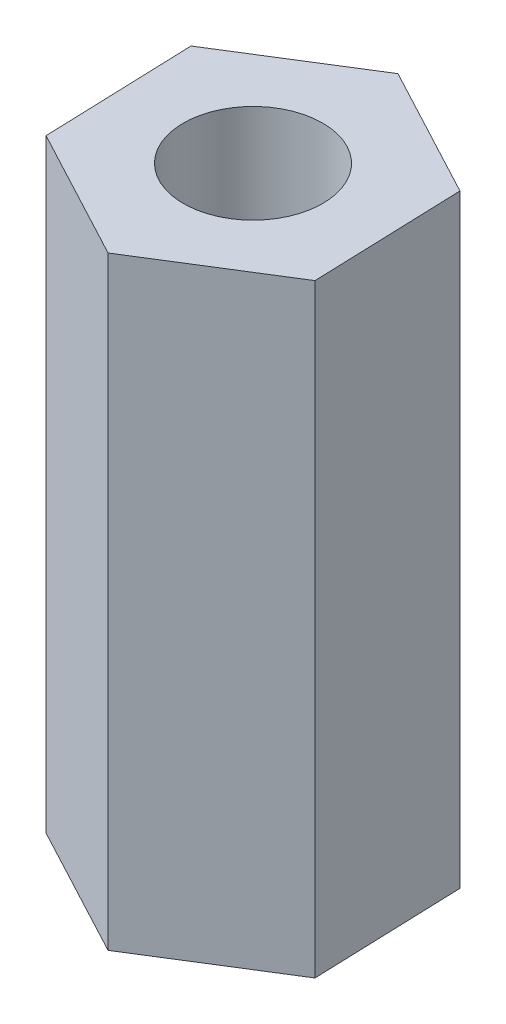
from build123d import *

# Parameters (mm, degrees)
SKETCH_1_R      = 1.5
EXTRUDE_1_DEPTH = 13


with BuildPart() as part:
    # 草图1 → 凸台-拉伸1 (new body)
    with BuildSketch(Plane(origin=(0, 0, 0), x_dir=(1, 0, 0), z_dir=(0, 1, 0))):
        Polygon((2.854062842, -1.519097964), (2.742608849, 1.712141943), (-0.111453993, 3.231239908), (-2.854062842, 1.519097964), (-2.742608849, -1.712141943), (0.111453993, -3.231239908), align=None)
        with Locations(Location((0, 0, 0), (0, 0, 90))):
            Circle(SKETCH_1_R, mode=Mode.SUBTRACT)
    extrude(amount=EXTRUDE_1_DEPTH)


solid = part.part
